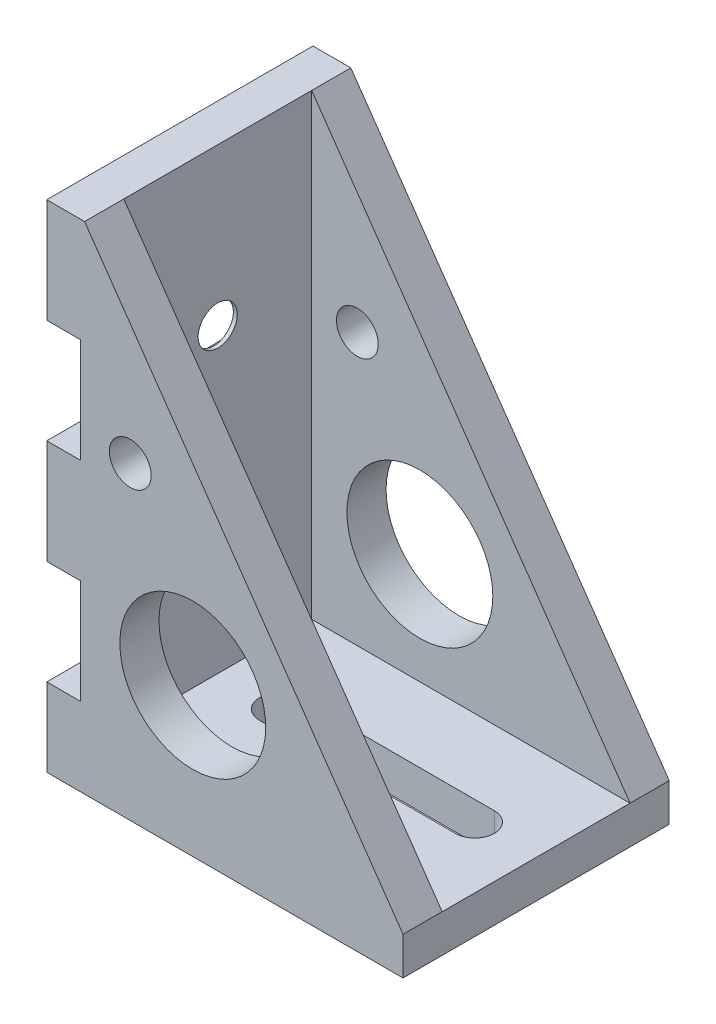
from build123d import *

# Parameters (mm, degrees)
CROQUIS1_R              = 5.59
CROQUIS1_R_2            = 1.6
SALIENTE_EXTRUIR1_DEPTH = 20.4
CROQUIS2_W              = 24.4
CROQUIS2_H              = 14.4
CORTAR_EXTRUIR1_DEPTH   = 35.1
CROQUIS3_R              = 1.5
CORTAR_EXTRUIR2_DEPTH   = 10
CORTAR_EXTRUIR3_DEPTH   = 10


with BuildPart() as part:
    # Croquis1 → Saliente-Extruir1 (new body)
    with BuildSketch(Plane.XY):
        Polygon((0, 0), (27.3, 0), (27.3, 2.9), (2.9, 38), (0, 38), (0, 30), (2.6, 30), (2.6, 22), (0, 22), (0, 14), (2.6, 14), (2.6, 6), (0, 6), align=None)
        with Locations((11.19, 11.3737)):
            Circle(CROQUIS1_R, mode=Mode.SUBTRACT)
        with Locations((6.4, 23.7)):
            Circle(CROQUIS1_R_2, mode=Mode.SUBTRACT)
    extrude(amount=-SALIENTE_EXTRUIR1_DEPTH)

    # Croquis2 → Cortar-Extruir1 (cut)
    with BuildSketch(Plane(origin=(0, 38, 0), x_dir=(1, 0, 0), z_dir=(0, 1, 0))):
        with Locations((15.1, 10.2)):
            Rectangle(CROQUIS2_W, CROQUIS2_H)
    extrude(amount=-CORTAR_EXTRUIR1_DEPTH, mode=Mode.SUBTRACT)

    # Croquis3 → Cortar-Extruir2 (cut)
    with BuildSketch(Plane.ZY.offset(-2.6)):
        with Locations(Location((-10.2, 26, 0), (0, 0, 270))):
            Circle(CROQUIS3_R)
        with Locations(Location((-10.2, 10, 0), (0, 0, 270))):
            Circle(CROQUIS3_R)
    extrude(amount=-CORTAR_EXTRUIR2_DEPTH, mode=Mode.SUBTRACT)

    # Croquis4 → Cortar-Extruir3 (cut)
    with BuildSketch(Plane(origin=(0, 2.9, 0), x_dir=(1, 0, 0), z_dir=(0, 1, 0))):
        with BuildLine():
            Line((22.6, 8.7), (7.6, 8.7))
            ThreePointArc((7.6, 8.7), (6.1, 10.2), (7.6, 11.7))
            Line((7.6, 11.7), (22.6, 11.7))
            ThreePointArc((22.6, 11.7), (24.1, 10.2), (22.6, 8.7))
        make_face()
    extrude(amount=-CORTAR_EXTRUIR3_DEPTH, mode=Mode.SUBTRACT)


solid = part.part
